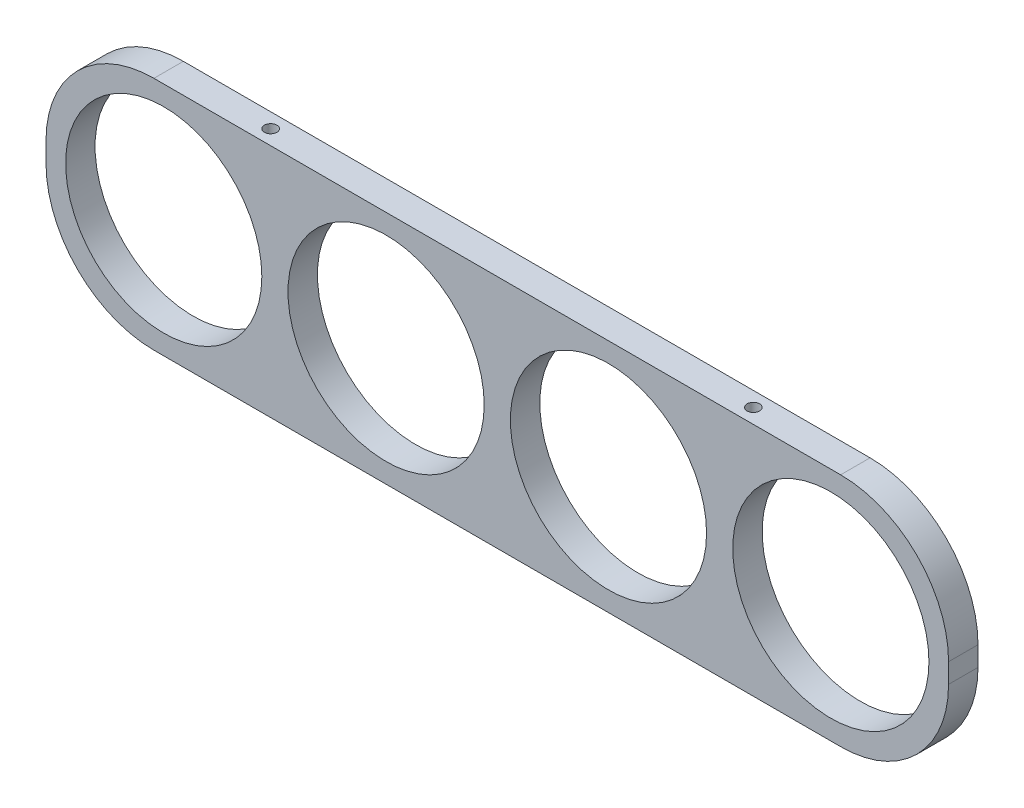
from build123d import *

# Parameters (mm, degrees)
SKETCH1_W                  = 292.1
SKETCH1_H                  = 76.2
BOSS_EXTRUDE1_DEPTH        = 4.7625
SKETCH2_R                  = 31.75
CUT_EXTRUDE1_DEPTH         = 152.23801812
FILLET1_R                  = 34.925
F_10_32_TAPPED_HOLE2_D     = 4.0386
F_10_32_TAPPED_HOLE2_DEPTH = 19.05
F_10_32_TAPPED_HOLE2_TIP   = 1.213317848


with BuildPart() as part:
    # Sketch1 → Boss-Extrude1 (new, symmetric)
    with BuildSketch(Plane.XY):
        Rectangle(SKETCH1_W, SKETCH1_H)
    extrude(amount=BOSS_EXTRUDE1_DEPTH, both=True)

    # Sketch2 → Cut-Extrude1 (cut, through all)
    with BuildSketch(Plane.XY.offset(4.7625)):
        with Locations((-107.95, 0)):
            Circle(SKETCH2_R)
        with Locations((-35.983333333, 0)):
            Circle(SKETCH2_R)
        with Locations((35.983333333, 0)):
            Circle(SKETCH2_R)
        with Locations((107.95, 0)):
            Circle(SKETCH2_R)
    extrude(amount=-CUT_EXTRUDE1_DEPTH, mode=Mode.SUBTRACT)

    # Fillet1
    fillet1_edges = [part.edges().sort_by_distance(p)[0] for p in [
        (-146.05, 38.1, 0),
        (146.05, 38.1, 0),
        (146.05, -38.1, 0),
        (-146.05, -38.1, 0),
    ]]
    fillet(fillet1_edges, radius=FILLET1_R)

    # #10-32 Tapped Hole2
    with Locations(Plane(origin=(0, 38.1, 0), x_dir=(1, 0, 0), z_dir=(0, 1, 0))):
        with Locations((-78.105, 0), (78.105, 0)):
            Hole(F_10_32_TAPPED_HOLE2_D / 2, depth=F_10_32_TAPPED_HOLE2_DEPTH)
            with Locations((0, 0, -(F_10_32_TAPPED_HOLE2_DEPTH + F_10_32_TAPPED_HOLE2_TIP / 2))):  # 118° drill point
                Cone(0, F_10_32_TAPPED_HOLE2_D / 2, F_10_32_TAPPED_HOLE2_TIP, mode=Mode.SUBTRACT)


solid = part.part
